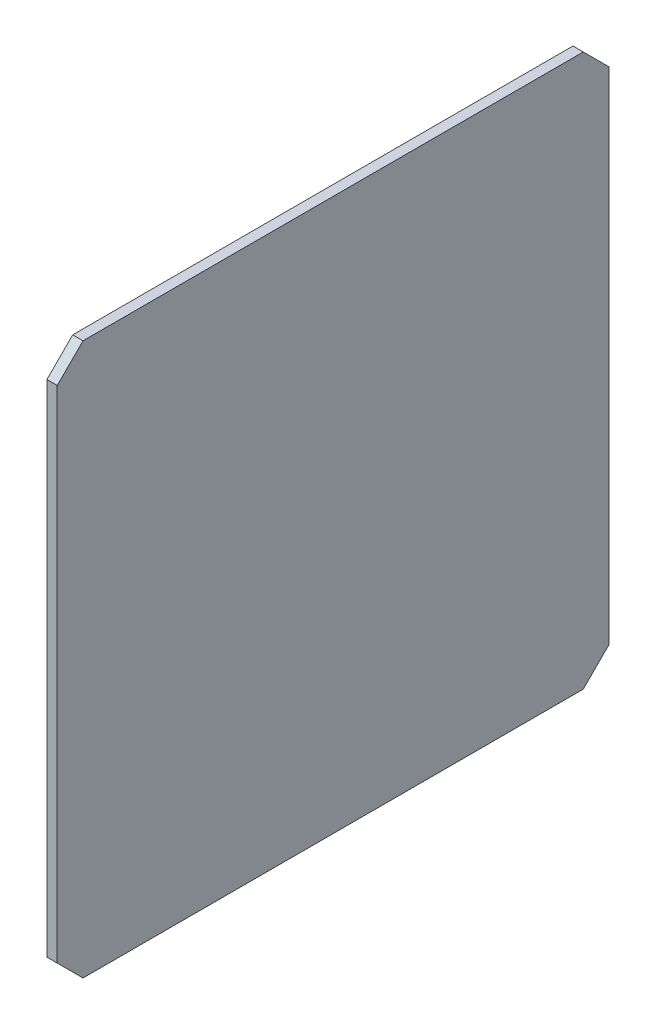
from build123d import *

# Parameters (mm, degrees)
BOSS_EXTRUDE1_DEPTH = 4


with BuildPart() as part:
    # Sketch1 → Boss-Extrude1 (new body)
    with BuildSketch(Plane(origin=(0, 0, 0), x_dir=(0, 0, -1), z_dir=(1, 0, 0))):
        Polygon((-107, 97), (-97, 107), (97, 107), (107, 97), (107, -97), (97, -107), (-97, -107), (-107, -97), align=None)
    extrude(amount=BOSS_EXTRUDE1_DEPTH)


solid = part.part
